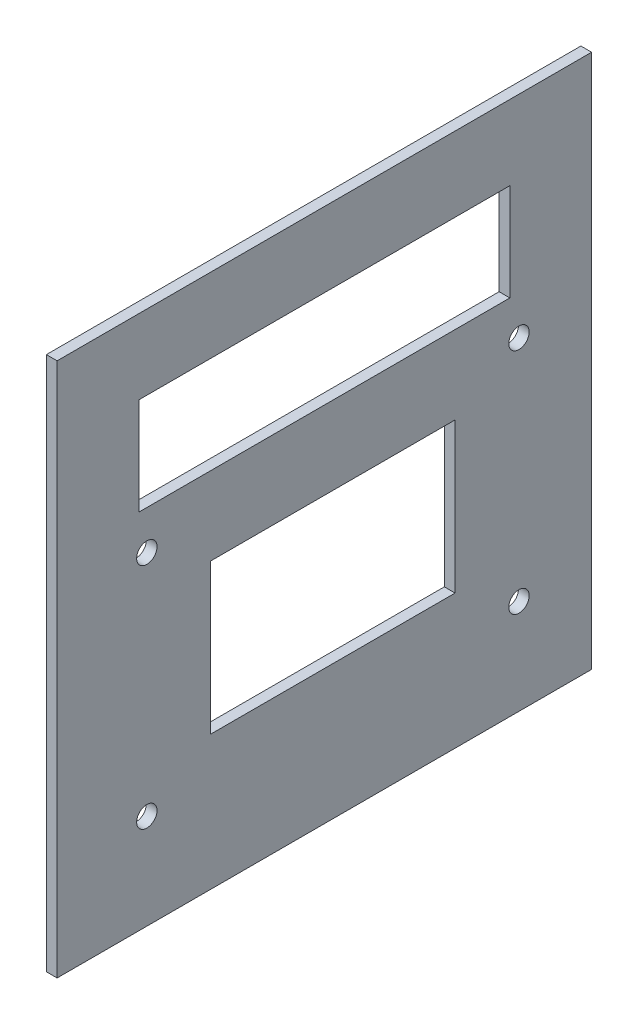
from build123d import *

# Parameters (mm, degrees)
SKETCH1_W           = 158
SKETCH1_H           = 158
SKETCH1_R           = 3.015623361
SKETCH1_W_2         = 109.668996446
SKETCH1_H_2         = 28.739233449
SKETCH1_W_3         = 72.233228696
SKETCH1_H_3         = 44.324935791
BOSS_EXTRUDE1_DEPTH = 3.175


with BuildPart() as part:
    # Sketch1 → Boss-Extrude1 (new body)
    with BuildSketch(Plane(origin=(0, 0, 0), x_dir=(0, 0, -1), z_dir=(1, 0, 0))):
        Rectangle(SKETCH1_W, SKETCH1_H)
        with Locations((-52.478878223, 16.641690282)):
            Circle(SKETCH1_R, mode=Mode.SUBTRACT)
        with Locations((57.521121777, 16.641690282)):
            Circle(SKETCH1_R, mode=Mode.SUBTRACT)
        with Locations((57.521121777, -50.858309718)):
            Circle(SKETCH1_R, mode=Mode.SUBTRACT)
        with Locations((-52.478878223, -50.858309718)):
            Circle(SKETCH1_R, mode=Mode.SUBTRACT)
        with Locations((0, 42.549463737)):
            Rectangle(SKETCH1_W_2, SKETCH1_H_2, mode=Mode.SUBTRACT)
        with Locations((2.521121777, -17.108309717)):
            Rectangle(SKETCH1_W_3, SKETCH1_H_3, mode=Mode.SUBTRACT)
    extrude(amount=BOSS_EXTRUDE1_DEPTH)


solid = part.part
